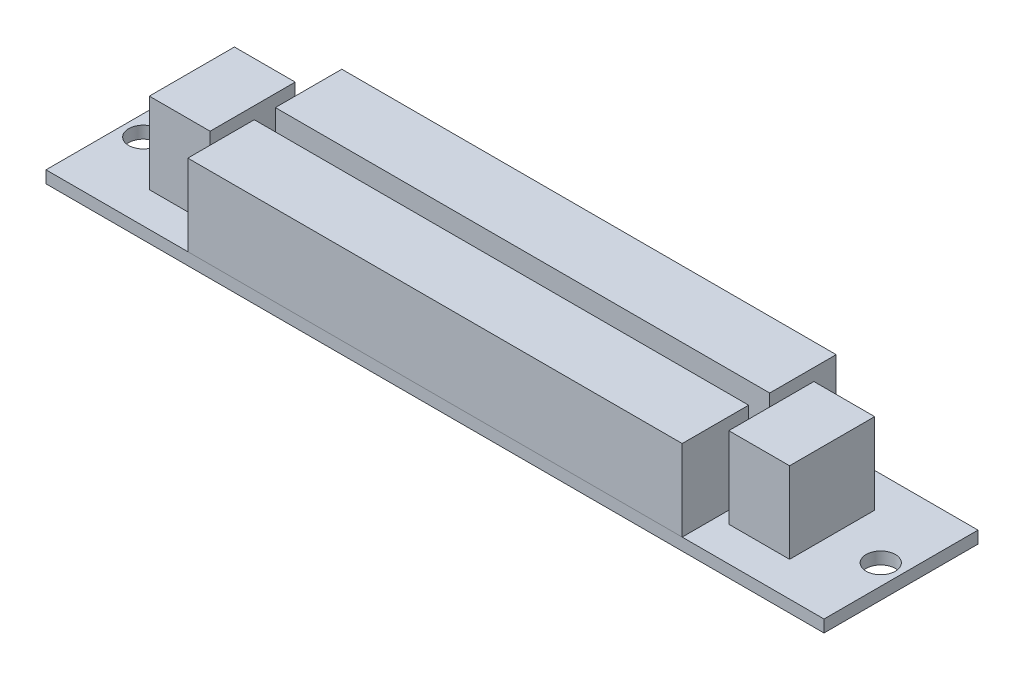
from build123d import *

# Parameters (mm, degrees)
SKETCH1_W                     = 96
SKETCH1_H                     = 19
BOSS_EXTRUDE1_DEPTH           = 1.5
SKETCH2_W                     = 79
SKETCH2_H                     = 19
BOSS_EXTRUDE2_DEPTH           = 10
SKETCH4_W                     = 1.8
SKETCH4_H                     = 1.5
M3_CLEARANCE_HOLE1_AT_2_COUNT = 2
M3_CLEARANCE_HOLE1_AT_2_PITCH = 91
SKETCH5_W                     = 7.5
SKETCH5_H                     = 4.25
SKETCH5_W_2                   = 61
SKETCH5_H_2                   = 2.6
CUT_EXTRUDE2_DEPTH            = 10


with BuildPart() as part:
    # Sketch1 → Boss-Extrude1 (new body)
    with BuildSketch(Plane(origin=(0, 0, 0), x_dir=(1, 0, 0), z_dir=(0, 1, 0))):
        with Locations((48, 9.5)):
            Rectangle(SKETCH1_W, SKETCH1_H)
    extrude(amount=BOSS_EXTRUDE1_DEPTH)

    # Sketch4 → M3 Clearance Hole1 (revolve, cut)
    with BuildSketch(Plane(origin=(2.5, 1.5, -9.5), x_dir=(0, 0, 1), z_dir=(1, 0, 0))):
        with Locations((0.9, 0.75)):
            Rectangle(SKETCH4_W, SKETCH4_H)
    m3_clearance_hole1 = revolve(axis=Axis((2.5, 7.85, -9.5), (0, -1, 0)), mode=Mode.SUBTRACT)

    # M3 Clearance Hole1 at 2: M3 Clearance Hole1 ×2
    with Locations(*[(i * M3_CLEARANCE_HOLE1_AT_2_PITCH, 0, 0) for i in range(1, M3_CLEARANCE_HOLE1_AT_2_COUNT)]):
        add(m3_clearance_hole1, mode=Mode.SUBTRACT)


with BuildPart() as body_2:
    # Sketch2 → Boss-Extrude2 (new body)
    with BuildSketch(Plane(origin=(0, 1.5, 0), x_dir=(1, 0, 0), z_dir=(0, 1, 0))):
        with Locations((48, 9.5)):
            Rectangle(SKETCH2_W, SKETCH2_H)
    extrude(amount=BOSS_EXTRUDE2_DEPTH)

    # Sketch5 → Cut-Extrude2 (cut)
    with BuildSketch(Plane(origin=(0, 11.5, 0), x_dir=(1, 0, 0), z_dir=(0, 1, 0))):
        with Locations((12.25, 16.875)):
            Rectangle(SKETCH5_W, SKETCH5_H)
        with Locations((12.25, 2.125)):
            Rectangle(SKETCH5_W, SKETCH5_H)
        Polygon((16, 19), (16, 14.75), (16, 4.25), (16, 0), (17.5, 0), (17.5, 8.2), (17.5, 10.8), (17.5, 19), align=None)
        with Locations((48, 9.5)):
            Rectangle(SKETCH5_W_2, SKETCH5_H_2)
        Polygon((80, 19), (78.5, 19), (78.5, 10.8), (78.5, 8.2), (78.5, 0), (80, 0), (80, 4.25), (80, 14.75), align=None)
        with Locations((83.75, 16.875)):
            Rectangle(SKETCH5_W, SKETCH5_H)
        with Locations((83.75, 2.125)):
            Rectangle(SKETCH5_W, SKETCH5_H)
    extrude(amount=-CUT_EXTRUDE2_DEPTH, mode=Mode.SUBTRACT)


with BuildPart() as cut_extrude2_piece_1:
    # of the separate pieces the step leaves, piece 1, a body of its own (cut_extrude2_pieces)
    add(body_2.part.solids().sort_by_distance((78.5, 1.5, 0))[0])


with BuildPart() as cut_extrude2_piece_2:
    # of the separate pieces the step leaves, piece 2, a body of its own (cut_extrude2_pieces)
    add(body_2.part.solids().sort_by_distance((17.5, 1.5, -19))[0])


with BuildPart() as cut_extrude2_piece_3:
    # of the separate pieces the step leaves, piece 3, a body of its own (cut_extrude2_pieces)
    add(body_2.part.solids().sort_by_distance((80, 1.5, -14.75))[0])


with BuildPart() as cut_extrude2_piece_4:
    # of the separate pieces the step leaves, piece 4, a body of its own (cut_extrude2_pieces)
    add(body_2.part.solids().sort_by_distance((8.5, 1.5, -4.25))[0])


solid = Compound([part.part, cut_extrude2_piece_1.part, cut_extrude2_piece_2.part, cut_extrude2_piece_3.part, cut_extrude2_piece_4.part])
